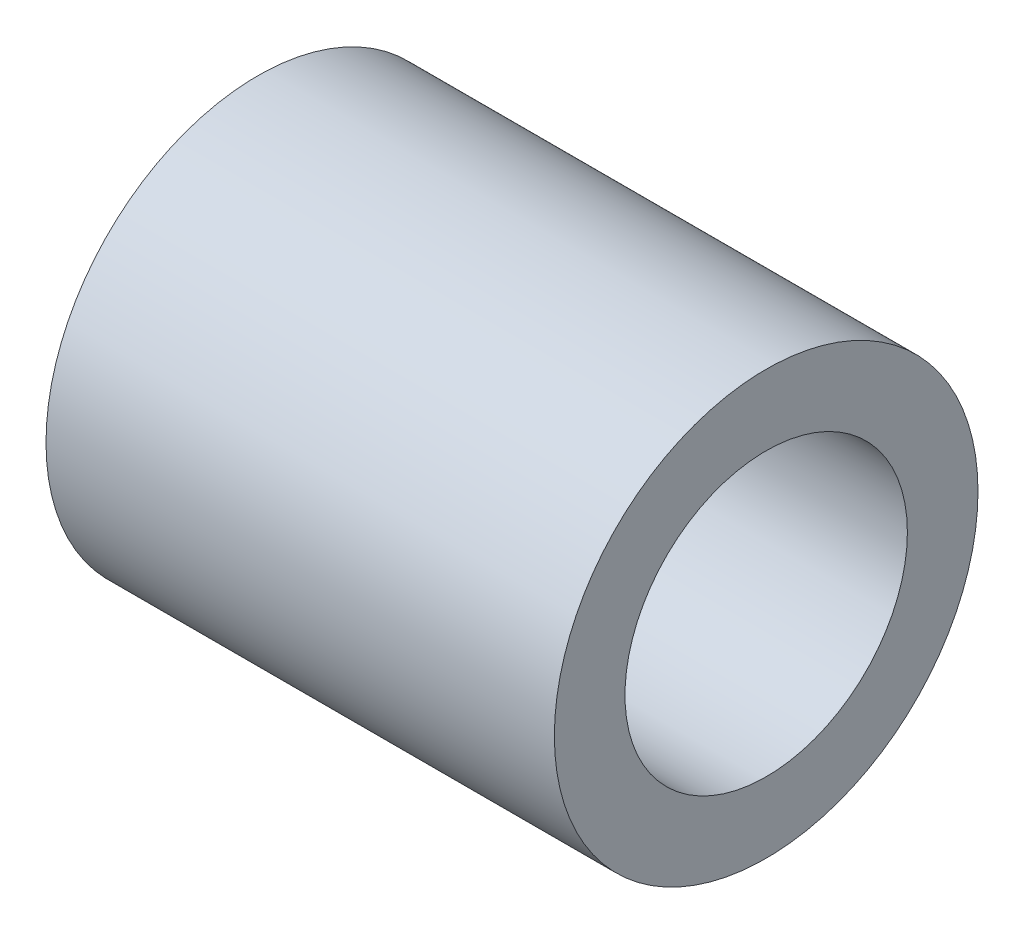
from build123d import *

# Parameters (mm, degrees)
SKETCH1_R           = 7.5
SKETCH1_R_2         = 5
BOSS_EXTRUDE1_DEPTH = 18


with BuildPart() as part:
    # Sketch1 → Boss-Extrude1 (new body)
    with BuildSketch(Plane(origin=(0, 0, 0), x_dir=(0, 0, -1), z_dir=(1, 0, 0))):
        Circle(SKETCH1_R)
        Circle(SKETCH1_R_2, mode=Mode.SUBTRACT)
    extrude(amount=BOSS_EXTRUDE1_DEPTH)


solid = part.part
